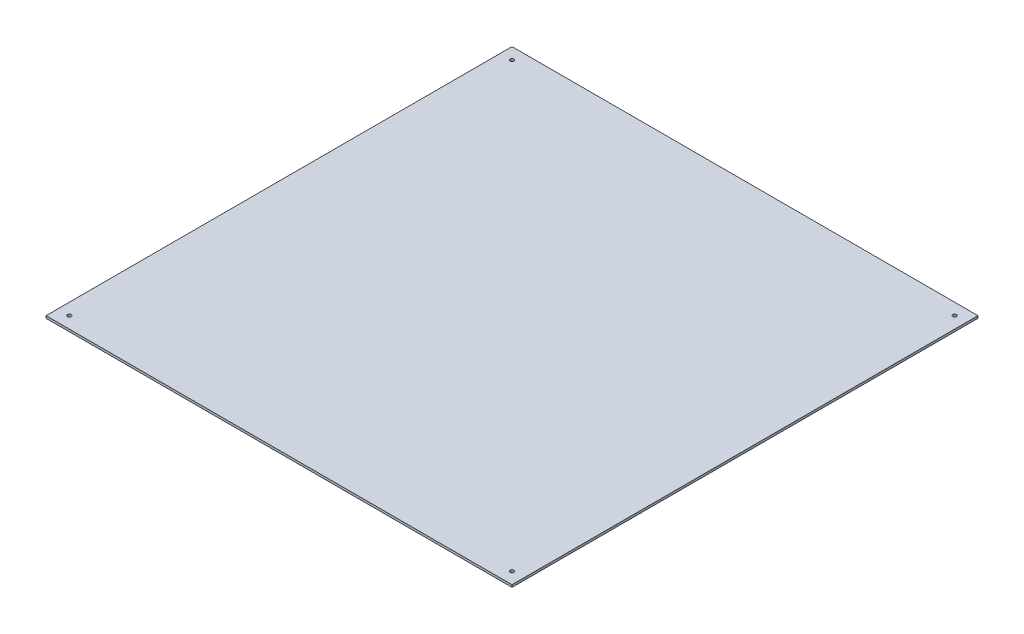
from build123d import *

# Parameters (mm, degrees)
SKETCH_1_W      = 1000
SKETCH_1_H      = 1000
EXTRUDE_1_DEPTH = 5
MM_1_D          = 8
MM_1_DEPTH      = 10
MM_1_TIP        = 2.403442476


with BuildPart() as part:
    # 草图1 → 凸台-拉伸1 (new body)
    with BuildSketch(Plane(origin=(0, 0, 0), x_dir=(1, 0, 0), z_dir=(0, 1, 0))):
        with Locations((-67.961165049, -133.009708738)):
            Rectangle(SKETCH_1_W, SKETCH_1_H)
    extrude(amount=EXTRUDE_1_DEPTH)

    # 大小mm 暗销孔1
    with Locations(Plane(origin=(407.038834951, 5, -341.990291262), x_dir=(0, 0, 1), z_dir=(0, 1, 0))):
        with Locations((0, 0), (0, -950), (950, -950), (950, 0)):
            Hole(MM_1_D / 2, depth=MM_1_DEPTH)
            with Locations((0, 0, -(MM_1_DEPTH + MM_1_TIP / 2))):  # 118° drill point
                Cone(0, MM_1_D / 2, MM_1_TIP, mode=Mode.SUBTRACT)


solid = part.part
